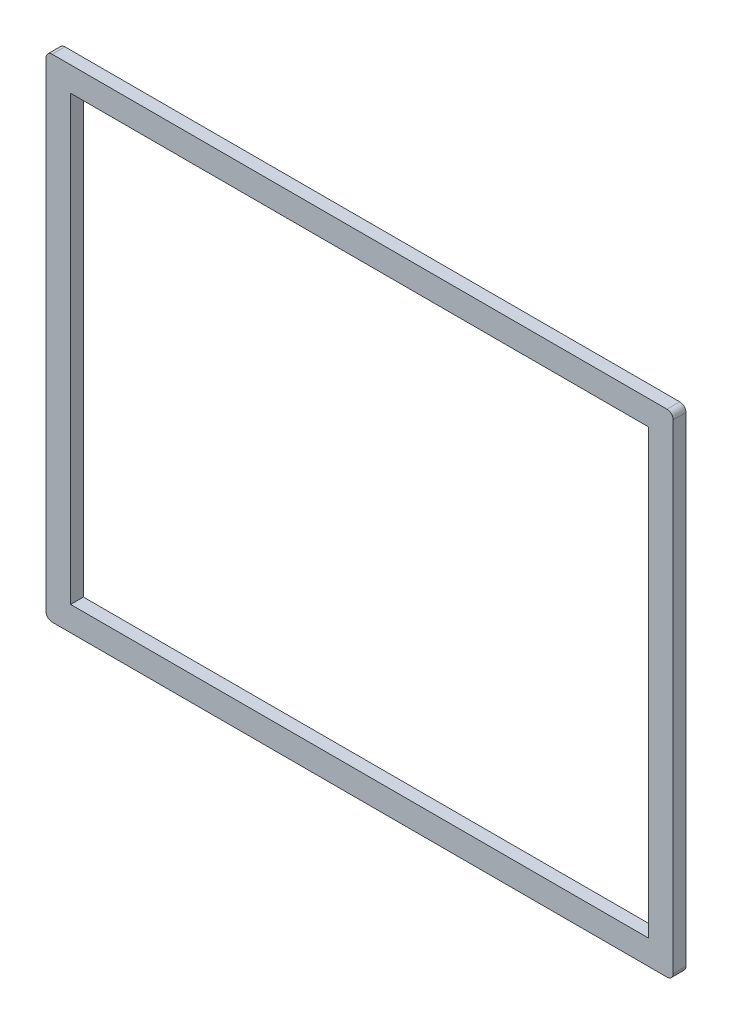
from build123d import *

# Parameters (mm, degrees)
SKETCH1_W      = 647.7
SKETCH1_H      = 508
SKETCH1_W_2    = 596.9
SKETCH1_H_2    = 457.2
EXTRUDE1_DEPTH = 13.208
FILLET1_R      = 6.35


with BuildPart() as part:
    # Sketch1 → Extrude1 (new body)
    with BuildSketch(Plane.XY):
        Rectangle(SKETCH1_W, SKETCH1_H)
        Rectangle(SKETCH1_W_2, SKETCH1_H_2, mode=Mode.SUBTRACT)
    extrude(amount=-EXTRUDE1_DEPTH)

    # Fillet1
    fillet1_edges = [part.edges().sort_by_distance(p)[0] for p in [
        (323.85, 254, -6.604),
        (323.85, -254, -6.604),
        (-323.85, -254, -6.604),
        (-323.85, 254, -6.604),
    ]]
    fillet(fillet1_edges, radius=FILLET1_R)


solid = part.part
